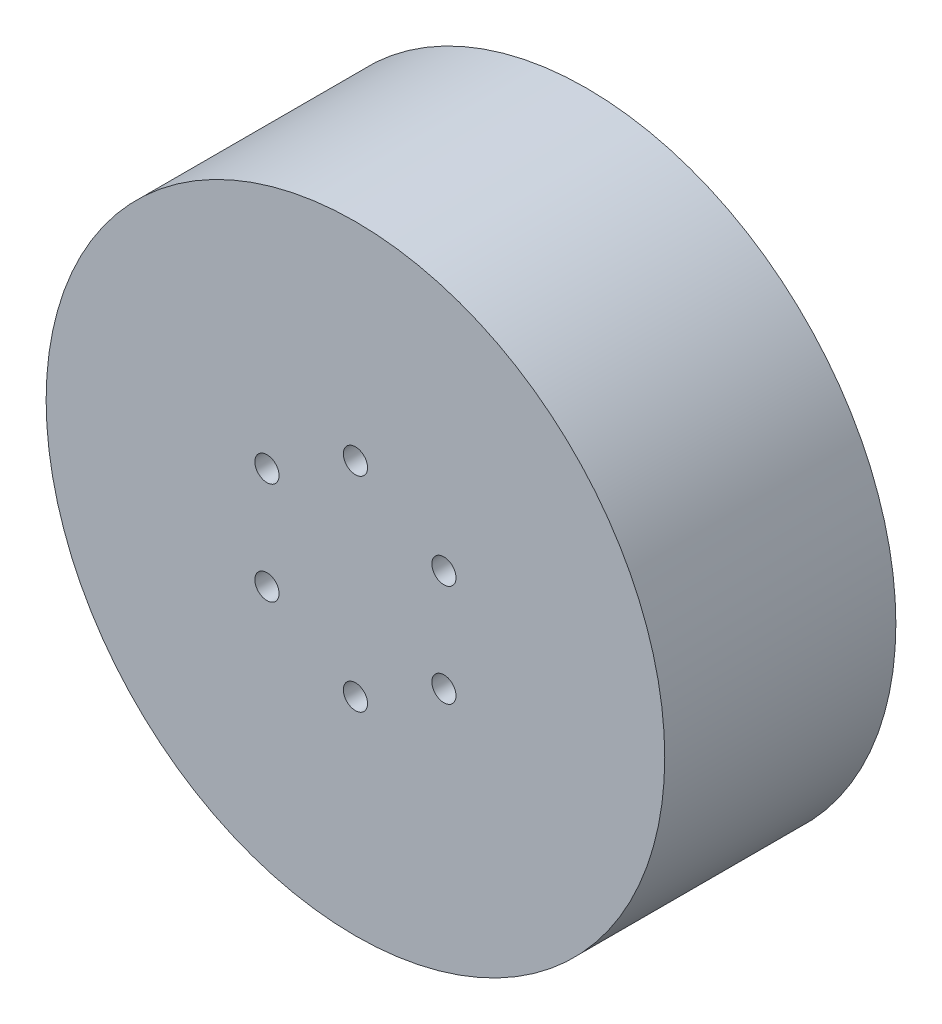
from build123d import *

# Parameters (mm, degrees)
SKETCH1_R               = 113.538
BOSS_EXTRUDE1_DEPTH     = 84.836
CUT_EXTRUDE1_DEPTH      = 182.600941033
CUT_EXTRUDE1_DEPTH_BACK = 182.600941033
SKETCH2_R               = 4.445
SKETCH4_R               = 23.841151021
BOSS_EXTRUDE2_DEPTH     = 13.97


with BuildPart() as part:
    # Sketch1 → Boss-Extrude1 (new body)
    with BuildSketch(Plane.XY):
        Circle(SKETCH1_R)
    extrude(amount=-BOSS_EXTRUDE1_DEPTH)

    # Sketch2 → Cut-Extrude1 (cut, two sides: drawn at the far end of the back side and taken through both)
    with BuildSketch(Plane.XY.offset(-CUT_EXTRUDE1_DEPTH_BACK)):
        with Locations((0, 37.49999993)):
            Circle(SKETCH2_R)
        with Locations((32.475952581, 18.749999965)):
            Circle(SKETCH2_R)
        with Locations((32.475952581, -18.749999965)):
            Circle(SKETCH2_R)
        with Locations((0, -37.49999993)):
            Circle(SKETCH2_R)
        with Locations((-32.475952581, -18.749999965)):
            Circle(SKETCH2_R)
        with Locations((-32.475952581, 18.749999965)):
            Circle(SKETCH2_R)
    extrude(amount=CUT_EXTRUDE1_DEPTH + CUT_EXTRUDE1_DEPTH_BACK, mode=Mode.SUBTRACT)

    # Sketch4 → Boss-Extrude2 (add)
    with BuildSketch(Plane(origin=(0, 0, -84.836), x_dir=(-1, 0, 0), z_dir=(0, 0, -1))):
        with Locations(Location((0, 0, 0), (0, 0, 180))):
            Circle(SKETCH4_R)
    extrude(amount=BOSS_EXTRUDE2_DEPTH)


solid = part.part
